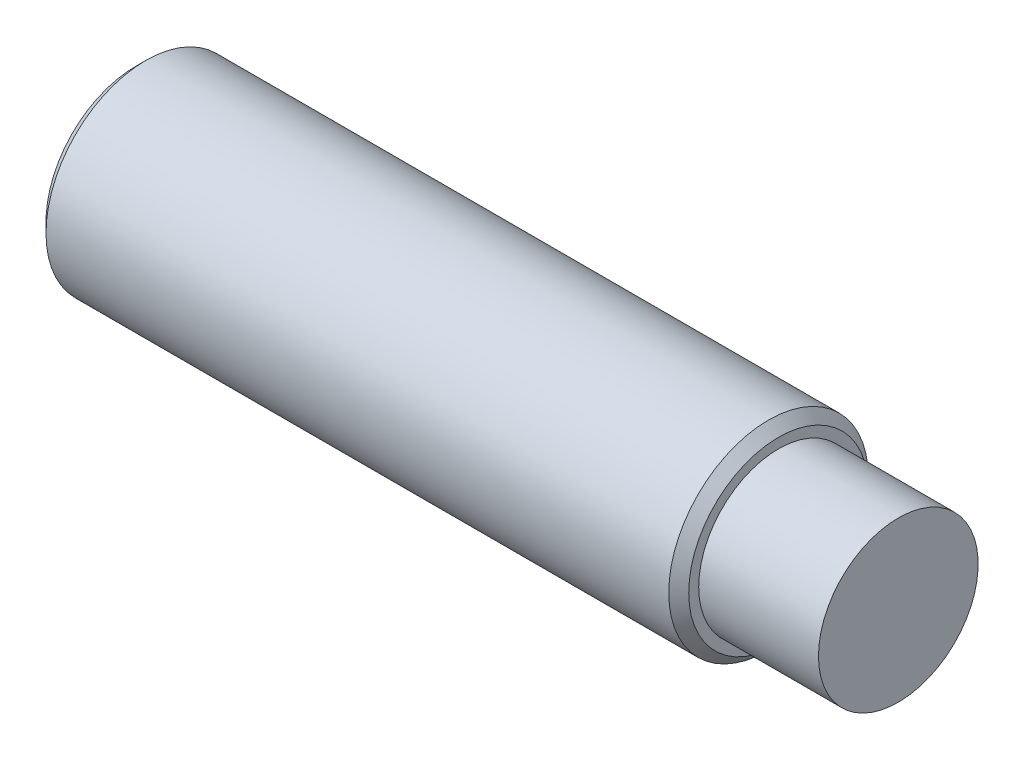
from build123d import *

# Parameters (mm, degrees)
CHAMFER1_SIZE      = 0.5
SKETCH6_R          = 2
CUT_EXTRUDE1_DEPTH = 10


with BuildPart() as part:
    # Sketch1 → Revolve1 (revolve)
    with BuildSketch(Plane.XY, mode=Mode.PRIVATE) as revolve1_sk:
        Polygon((0, 0), (0, 5), (32.2, 5), (32.2, 4), (38.2, 4), (38.2, 0), align=None)
    revolve(revolve1_sk.sketch.rotate(Axis((-21.625122332, 0, 0), (1, 0, 0)), 90), axis=Axis((-21.625122332, 0, 0), (1, 0, 0)))

    # Chamfer1
    chamfer1_edges = [part.edges().sort_by_distance(p)[0] for p in [
        (32.2, 0, -5),
        (0, 0, -5),
    ]]
    chamfer(chamfer1_edges, length=CHAMFER1_SIZE)

    # Sketch6 → Cut-Extrude1 (cut)
    with BuildSketch(Plane.ZY):
        Circle(SKETCH6_R)
    extrude(amount=-CUT_EXTRUDE1_DEPTH, mode=Mode.SUBTRACT)


solid = part.part
